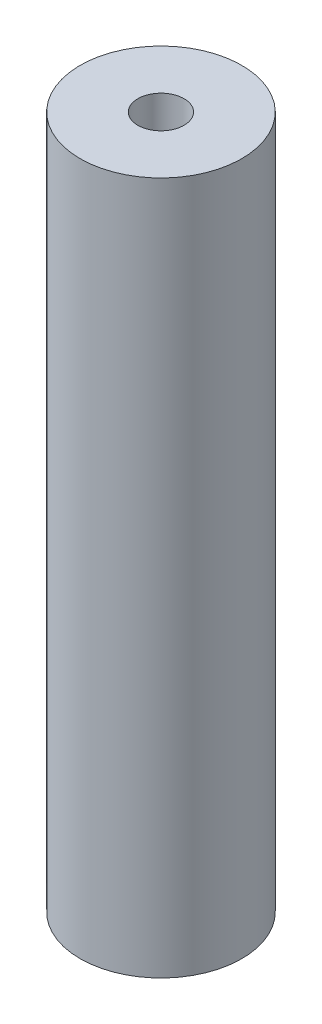
from build123d import *

# Parameters (mm, degrees)
SKETCH1_R           = 8.75
BOSS_EXTRUDE1_DEPTH = 75
SKETCH2_R           = 2.5
CUT_EXTRUDE1_DEPTH  = 131


with BuildPart() as part:
    # Sketch1 → Boss-Extrude1 (new body)
    with BuildSketch(Plane(origin=(0, 0, 0), x_dir=(1, 0, 0), z_dir=(0, 1, 0))):
        with Locations(Location((0, 0, 0), (0, 0, 270))):
            Circle(SKETCH1_R)
    extrude(amount=BOSS_EXTRUDE1_DEPTH)

    # Sketch2 → Cut-Extrude1 (cut)
    with BuildSketch(Plane(origin=(0, 0, 0), x_dir=(1, 0, 0), z_dir=(0, 1, 0))):
        with Locations(Location((0, 0, 0), (0, 0, 270))):
            Circle(SKETCH2_R)
    extrude(amount=CUT_EXTRUDE1_DEPTH, mode=Mode.SUBTRACT)


solid = part.part
